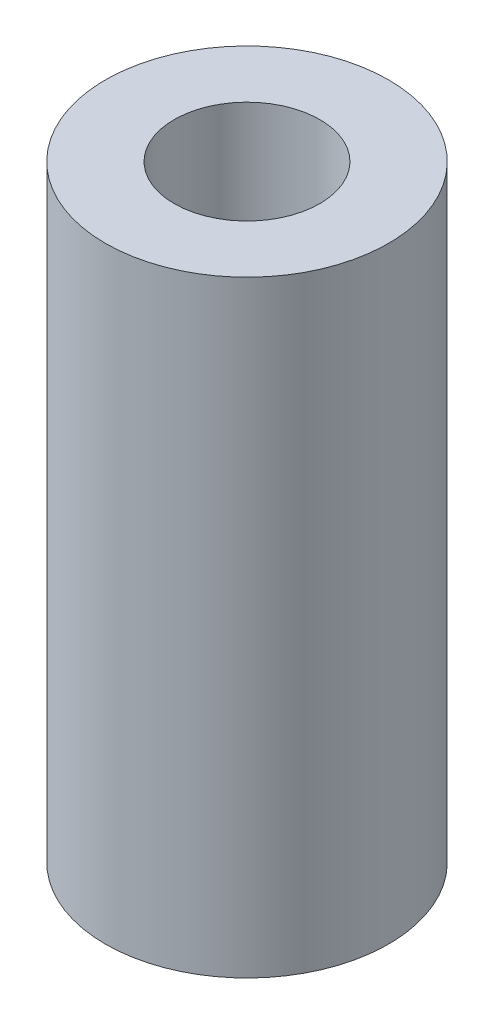
from build123d import *

# Parameters (mm, degrees)
SKETCH1_R           = 3.5
SKETCH1_R_2         = 1.8
BOSS_EXTRUDE1_DEPTH = 7.5


with BuildPart() as part:
    # Sketch1 → Boss-Extrude1 (new, symmetric)
    with BuildSketch(Plane(origin=(0, 0, 0), x_dir=(1, 0, 0), z_dir=(0, 1, 0))):
        with Locations(Location((0, 0, 0), (0, 0, 270))):
            Circle(SKETCH1_R)
        with Locations(Location((0, 0, 0), (0, 0, 270))):
            Circle(SKETCH1_R_2, mode=Mode.SUBTRACT)
    extrude(amount=BOSS_EXTRUDE1_DEPTH, both=True)


solid = part.part
